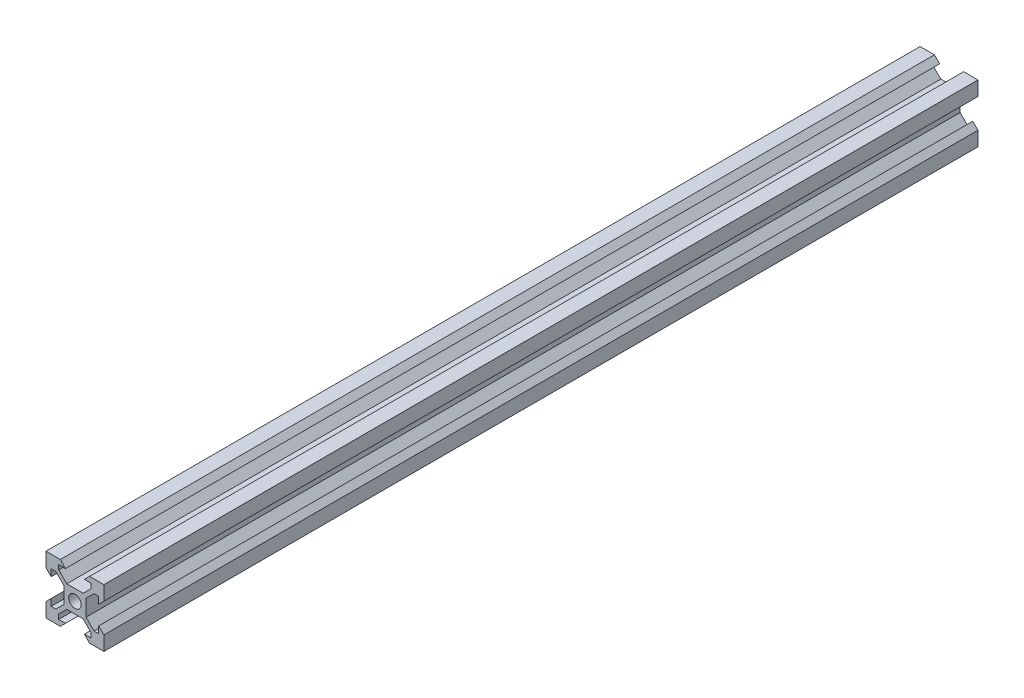
from build123d import *

# Parameters (mm, degrees)
CROQUIS1_R      = 2.15
BOSCHBASE_DEPTH = 302


with BuildPart() as part:
    # Croquis1 → BoschBase (new body)
    with BuildSketch(Plane.XY):
        Polygon((4.4, 0), (0, 0), (0, -0.56736664), (0, -4.4), (0, -4.95), (1.8, -6.75), (1.8, -4.4), (3.410050506, -4.4), (6.175, -7.164949494), (6.175, -12.835050506), (3.410050506, -15.6), (1.8, -15.6), (1.8, -13.25), (0, -15.05), (0, -15.6), (0, -20), (4.4, -20), (4.95, -20), (6.75, -18.2), (4.4, -18.2), (4.4, -16.589949494), (7.164949494, -13.825), (12.835050506, -13.825), (15.6, -16.589949494), (15.6, -18.2), (13.25, -18.2), (15.05, -20), (15.6, -20), (18.2, -20), (20, -20), (20, -15.6), (20, -15.05), (18.2, -13.25), (18.2, -15.6), (16.589949494, -15.6), (13.825, -12.835050506), (13.825, -7.164949494), (16.589949494, -4.4), (18.2, -4.4), (18.2, -6.75), (20, -4.95), (20, -4.4), (20, 0), (15.6, 0), (15.05, 0), (13.25, -1.8), (15.6, -1.8), (15.6, -3.410050506), (12.835050506, -6.175), (7.164949494, -6.175), (4.4, -3.410050506), (4.4, -1.8), (6.75, -1.8), (4.95, 0), align=None)
        with Locations((10, -10)):
            Circle(CROQUIS1_R, mode=Mode.SUBTRACT)
    extrude(amount=BOSCHBASE_DEPTH)


solid = part.part
